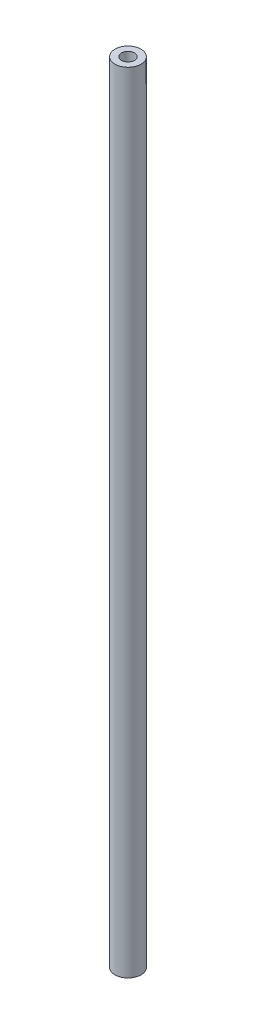
from build123d import *

# Parameters (mm, degrees)
SKETCH1_R           = 6.35
SKETCH1_R_2         = 3.175
BOSS_EXTRUDE1_DEPTH = 384.302


with BuildPart() as part:
    # Sketch1 → Boss-Extrude1 (new body)
    with BuildSketch(Plane(origin=(0, 0, 0), x_dir=(1, 0, 0), z_dir=(0, 1, 0))):
        with Locations(Location((0, 0, 0), (0, 0, 270))):
            Circle(SKETCH1_R)
        with Locations(Location((0, 0, 0), (0, 0, 270))):
            Circle(SKETCH1_R_2, mode=Mode.SUBTRACT)
    extrude(amount=BOSS_EXTRUDE1_DEPTH)


solid = part.part
